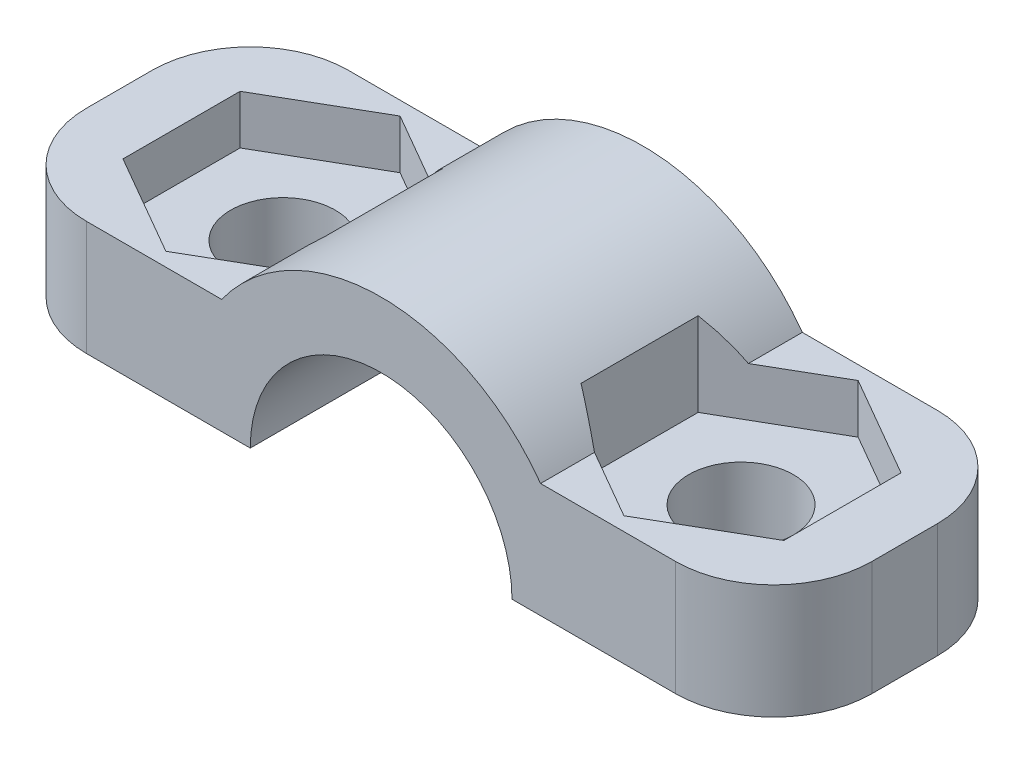
from build123d import *

# Parameters (mm, degrees)
BOSS_EXTRUDE1_DEPTH = 8
CUT_EXTRUDE1_REACH  = 17.62
SKETCH3_R           = 1.6
CUT_EXTRUDE2_DEPTH  = 4
FILLET1_R           = 3
SKETCH5_W           = 3
SKETCH5_H           = 2.5
CUT_EXTRUDE3_DEPTH  = 16.620499352


with BuildPart() as part:
    # Sketch1 → Boss-Extrude1 (new body)
    with BuildSketch(Plane.XY):
        with BuildLine():
            Line((-4, 0), (-12, 0))
            Line((-12, 0), (-12, 6))
            Line((-12, 6), (12, 6))
            Line((12, 6), (12, 0))
            Line((12, 0), (4, 0))
            ThreePointArc((4, 0), (0, 4), (-4, 0))
        make_face()
    extrude(amount=BOSS_EXTRUDE1_DEPTH)

    # Sketch3 → Cut-Extrude1 (cut, up to next)
    with BuildSketch(Plane.XZ, mode=Mode.PRIVATE) as cut_extrude1_sk1:
        with Locations((7, 4)):
            Circle(SKETCH3_R)
    cut_extrude1_tool1 = extrude(cut_extrude1_sk1.sketch, amount=-CUT_EXTRUDE1_REACH, mode=Mode.PRIVATE) & part.part
    # Sketch3 → Cut-Extrude1 (cut, up to next)
    with BuildSketch(Plane.XZ, mode=Mode.PRIVATE) as cut_extrude1_sk2:
        with Locations((-7, 4)):
            Circle(SKETCH3_R)
    cut_extrude1_tool2 = extrude(cut_extrude1_sk2.sketch, amount=-CUT_EXTRUDE1_REACH, mode=Mode.PRIVATE) & part.part
    add(cut_extrude1_tool1.solids().sort_by_distance((7, 0, 4))[0], mode=Mode.SUBTRACT)
    add(cut_extrude1_tool2.solids().sort_by_distance((-7, 0, 4))[0], mode=Mode.SUBTRACT)

    # Sketch4 → Cut-Extrude2 (cut)
    with BuildSketch(Plane(origin=(0, 6, 0), x_dir=(1, 0, 0), z_dir=(0, 1, 0))):
        Polygon((7, -0.420428331), (3.9, -2.210214166), (3.9, -5.789785834), (7, -7.579571669), (10.1, -5.789785834), (10.1, -2.210214166), align=None)
        Polygon((-7, -0.420428331), (-10.1, -2.210214166), (-10.1, -5.789785834), (-7, -7.579571669), (-3.9, -5.789785834), (-3.9, -2.210214166), align=None)
    extrude(amount=-CUT_EXTRUDE2_DEPTH, mode=Mode.SUBTRACT)

    # Fillet1
    fillet1_edges = [part.edges().sort_by_distance(p)[0] for p in [
        (12, 3, 8),
        (-12, 3, 8),
        (-12, 3, 0),
        (12, 3, 0),
    ]]
    fillet(fillet1_edges, radius=FILLET1_R)

    # Sketch5 → Cut-Extrude3 (cut, through all)
    with BuildSketch(Plane(origin=(0, 0, 0), x_dir=(-1, 0, 0), z_dir=(0, 0, -1))):
        with BuildLine():
            Line((-9, 6), (-9, 3.5))
            Line((-9, 3.5), (-4.873397172, 3.5))
            ThreePointArc((-4.873397172, 3.5), (-2.738612785, 5.338539127), (6e-09, 6))
            Line((6e-09, 6), (-9, 6))
        make_face()
        with Locations((-10.5, 4.75)):
            Rectangle(SKETCH5_W, SKETCH5_H)
        with BuildLine():
            Line((9, 6), (6e-09, 6))
            ThreePointArc((6e-09, 6), (2.73861279, 5.338539125), (4.873397172, 3.5))
            Line((4.873397172, 3.5), (9, 3.5))
            Line((9, 3.5), (9, 6))
        make_face()
        with Locations((10.5, 4.75)):
            Rectangle(SKETCH5_W, SKETCH5_H)
    extrude(amount=-CUT_EXTRUDE3_DEPTH, mode=Mode.SUBTRACT)


solid = part.part
